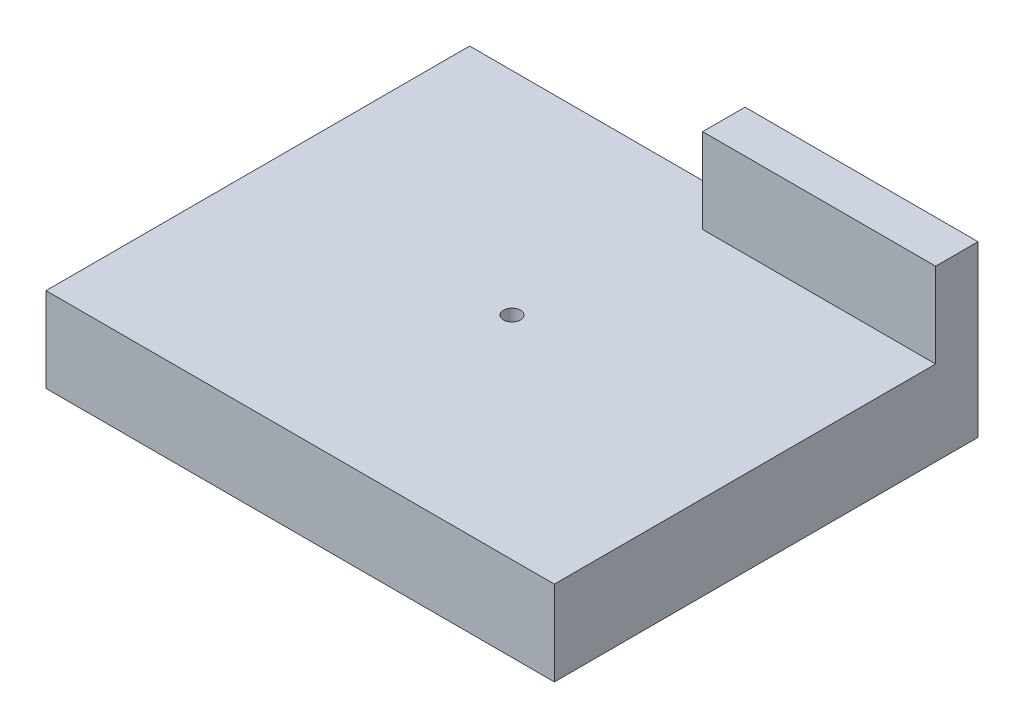
from build123d import *

# Parameters (mm, degrees)
SKETCH1_W             = 60
SKETCH1_H             = 50
BOSS_EXTRUDE1_DEPTH   = 20
CUT_EXTRUDE1_DEPTH    = 10
F_2MM_DIAMETER_HOLE_D = 2


with BuildPart() as part:
    # Sketch1 → Boss-Extrude1 (new body)
    with BuildSketch(Plane(origin=(0, 0, 0), x_dir=(1, 0, 0), z_dir=(0, 1, 0))):
        Rectangle(SKETCH1_W, SKETCH1_H)
    extrude(amount=BOSS_EXTRUDE1_DEPTH)

    # Sketch2 → Cut-Extrude1 (cut)
    with BuildSketch(Plane(origin=(0, 20, 0), x_dir=(1, 0, 0), z_dir=(0, 1, 0))):
        Polygon((-30, 25), (2.5, 25), (2.5, 20), (30, 20), (30, -25), (2.5, -25), (-30, -25), align=None)
    extrude(amount=-CUT_EXTRUDE1_DEPTH, mode=Mode.SUBTRACT)

    # 2mm Diameter Hole (through all)
    with Locations(Plane(origin=(0, 10, 0), x_dir=(1, 0, 0), z_dir=(0, 1, 0))):
        with Locations((0, 0)):
            Hole(F_2MM_DIAMETER_HOLE_D / 2)


solid = part.part
